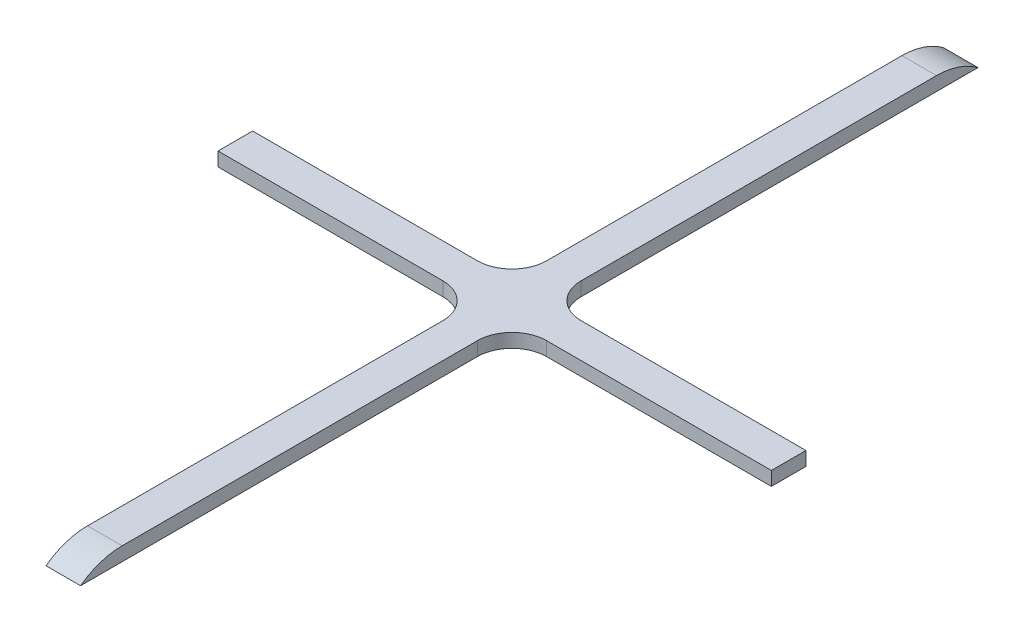
from build123d import *

# Parameters (mm, degrees)
BOSS_EXTRUDE1_DEPTH = 5
SKETCH2_W           = 10
SKETCH2_H           = 4
BOSS_EXTRUDE2_DEPTH = 80
FILLET1_R           = 10


with BuildPart() as part:
    # Sketch1 → Boss-Extrude1 (new, symmetric)
    with BuildSketch(Plane(origin=(0, 0, 0), x_dir=(0, 0, -1), z_dir=(1, 0, 0))):
        with BuildLine():
            Line((-75.25, 40), (160.25, 40))
            ThreePointArc((160.25, 40), (166.57455532, 38.973665961), (172.25, 36))
            Line((172.25, 36), (-87.25, 36))
            ThreePointArc((-87.25, 36), (-81.57455532, 38.973665961), (-75.25, 40))
        make_face()
    extrude(amount=BOSS_EXTRUDE1_DEPTH, both=True)

    # Sketch2 → Boss-Extrude2 (add, symmetric)
    with BuildSketch(Plane(origin=(0, 0, 0), x_dir=(0, 0, -1), z_dir=(1, 0, 0))):
        with Locations((42.5, 38)):
            Rectangle(SKETCH2_W, SKETCH2_H)
    extrude(amount=BOSS_EXTRUDE2_DEPTH, both=True)

    # Fillet1
    fillet1_edges = [part.edges().sort_by_distance(p)[0] for p in [
        (-5, 38, -47.5),
        (-5, 38, -37.5),
        (5, 38, -37.5),
        (5, 38, -47.5),
    ]]
    fillet(fillet1_edges, radius=FILLET1_R)


solid = part.part
